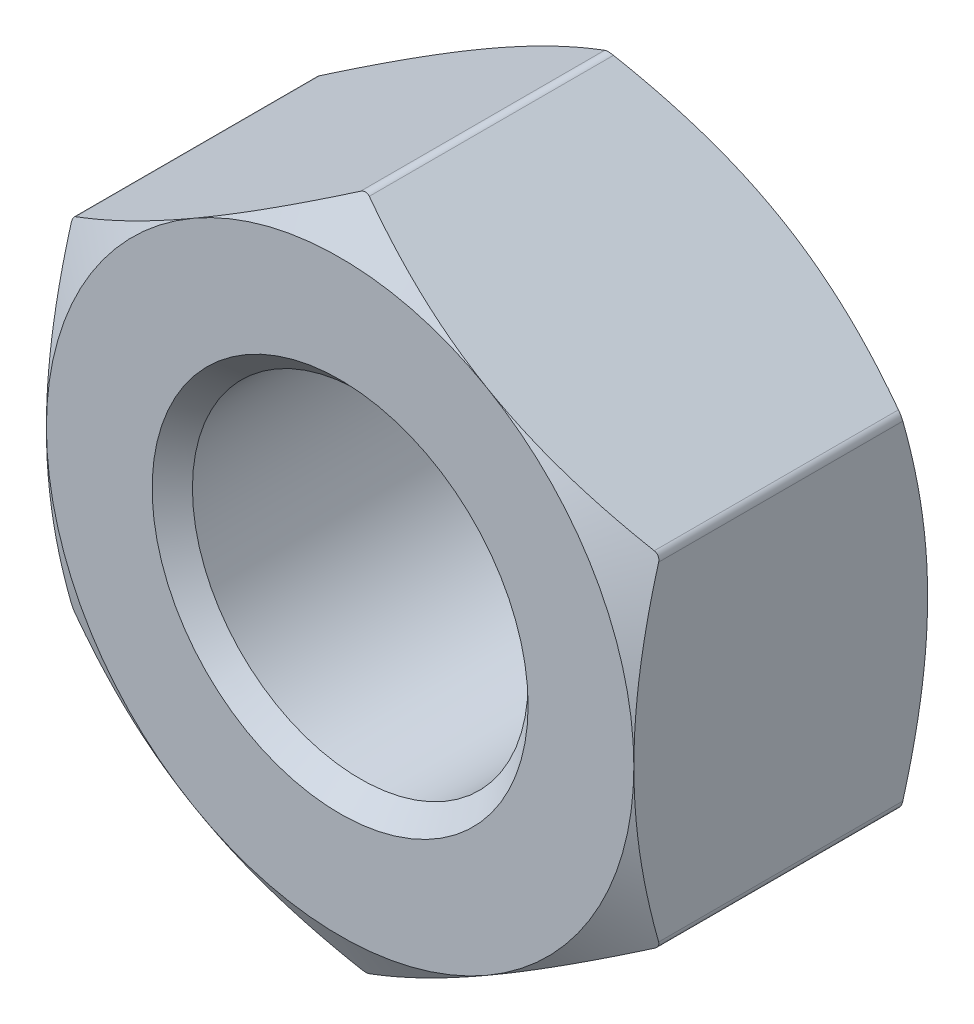
from build123d import *

# Parameters (mm, degrees)
SKETCH3_R           = 3.175
BOSS_EXTRUDE1_DEPTH = 2.778125
SKETCH4_OUTSIDE_W   = 55.29
SKETCH4_OUTSIDE_H   = 57.01
SKETCH4_OUTSIDE_R   = 5.55625
CUT_EXTRUDE1_DEPTH  = 11.1442782
CUT_EXTRUDE1_DRAFT  = -60
CUT_EXTRUDE2_START  = -5.55625
SKETCH4_2_OUTSIDE_W = 74.536
SKETCH4_2_OUTSIDE_H = 76.256
SKETCH4_2_OUTSIDE_R = 5.55625
CUT_EXTRUDE2_DEPTH  = 16.7005282
CUT_EXTRUDE2_DRAFT  = 60
FILLET1_R           = 0.1666875
CHAMFER1_SIZE       = 0.381


with BuildPart() as part:
    # Sketch3 → Boss-Extrude1 (new, symmetric)
    with BuildSketch(Plane.XY):
        Polygon((0, 6.415804866), (-5.55625, 3.207902433), (-5.55625, -3.207902433), (0, -6.415804866), (5.55625, -3.207902433), (5.55625, 3.207902433), align=None)
        Circle(SKETCH3_R, mode=Mode.SUBTRACT)
    extrude(amount=BOSS_EXTRUDE1_DEPTH, both=True)


with BuildPart() as cut_extrude1_tool:
    # Sketch4 outside → Cut-Extrude1 (with draft: the straight prism first)
    with BuildSketch(Plane.XY.offset(2.778125)):
        Rectangle(SKETCH4_OUTSIDE_W, SKETCH4_OUTSIDE_H)
        Circle(SKETCH4_OUTSIDE_R, mode=Mode.SUBTRACT)
    extrude(amount=-CUT_EXTRUDE1_DEPTH)
    # Cut-Extrude1: the draft: its side faces are tilted about the plane it starts from
    cut_extrude1_sides = [cut_extrude1_tool.faces().sort_by_distance(p)[0] for p in [
        (0, -28.505, -2.7940141),
        (27.645, 0, -2.7940141),
        (0, 28.505, -2.7940141),
        (-27.645, 0, -2.7940141),
        (-5.55625, 0, -2.7940141),
    ]]
    draft(cut_extrude1_sides, Plane.XY.offset(2.778125), CUT_EXTRUDE1_DRAFT)


with BuildPart() as part_1:
    add(part.part)

    # Cut-Extrude1: cut by cut_extrude1_tool
    add(cut_extrude1_tool.part, mode=Mode.SUBTRACT)


with BuildPart() as cut_extrude2_tool:
    # Sketch4<2> outside → Cut-Extrude2 (with draft: the straight prism first)
    with BuildSketch(Plane.XY.offset(2.778125).offset(CUT_EXTRUDE2_START)):
        Rectangle(SKETCH4_2_OUTSIDE_W, SKETCH4_2_OUTSIDE_H)
        Circle(SKETCH4_2_OUTSIDE_R, mode=Mode.SUBTRACT)
    extrude(amount=CUT_EXTRUDE2_DEPTH)
    # Cut-Extrude2: the draft: its side faces are tilted about the plane it starts from
    cut_extrude2_sides = [cut_extrude2_tool.faces().sort_by_distance(p)[0] for p in [
        (0, -38.128, 5.5721391),
        (37.268, 0, 5.5721391),
        (0, 38.128, 5.5721391),
        (-37.268, 0, 5.5721391),
        (-5.55625, 0, 5.5721391),
    ]]
    draft(cut_extrude2_sides, Plane.XY.offset(2.778125).offset(CUT_EXTRUDE2_START), CUT_EXTRUDE2_DRAFT)


with BuildPart() as part_2:
    add(part_1.part)

    # Cut-Extrude2: cut by cut_extrude2_tool
    add(cut_extrude2_tool.part, mode=Mode.SUBTRACT)

    # Fillet1
    fillet1_edges = [part_2.edges().sort_by_distance(p)[0] for p in [
        (5.55625, -3.207902433, 0),
        (0, -6.415804866, 0),
        (-5.55625, -3.207902433, 0),
        (-5.55625, 3.207902433, 0),
        (0, 6.415804866, 0),
        (5.55625, 3.207902433, 0),
    ]]
    fillet(fillet1_edges, radius=FILLET1_R)

    # Chamfer1
    chamfer1_edges = [part_2.edges().sort_by_distance(p)[0] for p in [
        (-3.175, 0, -2.778125),
        (-3.175, 0, 2.778125),
    ]]
    chamfer(chamfer1_edges, length=CHAMFER1_SIZE)


solid = part_2.part
